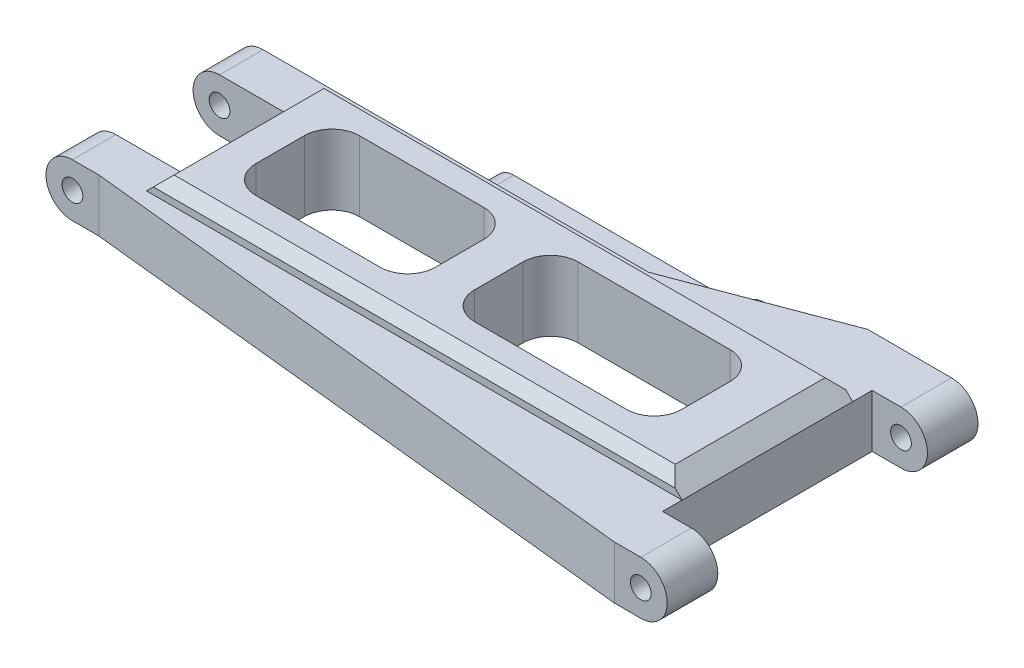
from build123d import *

# Parameters (mm, degrees)
SKETCH1_R           = 1.5
BOSS_EXTRUDE1_DEPTH = 22.5
SKETCH2_W           = 3.83
SKETCH2_H           = 8.7
SKETCH2_W_2         = 8
SKETCH2_H_2         = 30.35
SKETCH2_W_3         = 13.1
SKETCH2_H_3         = 15
CUT_EXTRUDE1_DEPTH  = 55.757415023
BOSS_EXTRUDE2_START = 6.33
SKETCH3_W           = 77.56
SKETCH3_H           = 24.7
BOSS_EXTRUDE2_DEPTH = 6.33
CHAMFER1_SIZE       = 2.5
CHAMFER2_SIZE       = 1.5
BOSS_EXTRUDE3_DEPTH = 3.31
SKETCH5_R           = 3
BOSS_EXTRUDE4_DEPTH = 2.4
FILLET1_R           = 0.5
SKETCH6_R           = 1.25
CUT_EXTRUDE2_DEPTH  = 10


with BuildPart() as part:
    # Sketch1 → Boss-Extrude1 (new, symmetric)
    with BuildSketch(Plane.XY):
        with BuildLine():
            Line((-45.5, 3.83), (45.5, 3.83))
            ThreePointArc((45.5, 3.83), (49.33, 0), (45.5, -3.83))
            Line((45.5, -3.83), (-45.5, -3.83))
            ThreePointArc((-45.5, -3.83), (-49.33, 0), (-45.5, 3.83))
        make_face()
        with Locations(Location((-45.5, 0, 0), (0, 0, 180))):
            Circle(SKETCH1_R, mode=Mode.SUBTRACT)
        with Locations(Location((45.5, 0, 0), (0, 0, 180))):
            Circle(SKETCH1_R, mode=Mode.SUBTRACT)
    extrude(amount=BOSS_EXTRUDE1_DEPTH, both=True)

    # Sketch2 → Cut-Extrude1 (cut, through all)
    with BuildSketch(Plane(origin=(0, 3.83, 0), x_dir=(1, 0, 0), z_dir=(0, 1, 0))):
        Polygon((-10.33, 13.8), (45.5, 13.8), (45.5, 22.5), (-33.33, 22.5), align=None)
        Polygon((41.67, -13.8), (-41.67, -22.5), (45.5, -22.5), (45.5, -13.8), align=None)
        with Locations((47.415, -18.15)):
            Rectangle(SKETCH2_W, SKETCH2_H)
        with Locations((47.415, 18.15)):
            Rectangle(SKETCH2_W, SKETCH2_H)
        with BuildLine():
            Line((-6.43, 7.5), (-28.43, 7.5))
            ThreePointArc((-28.43, 7.5), (-31.258427125, 6.328427125), (-32.43, 3.5))
            Line((-32.43, 3.5), (-32.43, -3.5))
            ThreePointArc((-32.43, -3.5), (-31.258427125, -6.328427125), (-28.43, -7.5))
            Line((-28.43, -7.5), (-6.43, -7.5))
            ThreePointArc((-6.43, -7.5), (-3.601572875, -6.328427125), (-2.43, -3.5))
            Line((-2.43, -3.5), (-2.43, 3.5))
            ThreePointArc((-2.43, 3.5), (-3.601572875, 6.328427125), (-6.43, 7.5))
        make_face()
        with BuildLine():
            Line((25.23, 7.5), (7.23, 7.5))
            ThreePointArc((7.23, 7.5), (4.401572875, 6.328427125), (3.23, 3.5))
            Line((3.23, 3.5), (3.23, -3.5))
            ThreePointArc((3.23, -3.5), (4.401572875, -6.328427125), (7.23, -7.5))
            Line((7.23, -7.5), (25.23, -7.5))
            ThreePointArc((25.23, -7.5), (28.058427125, -6.328427125), (29.23, -3.5))
            Line((29.23, -3.5), (29.23, 3.5))
            ThreePointArc((29.23, 3.5), (28.058427125, 6.328427125), (25.23, 7.5))
        make_face()
        with Locations((-45.33, 0)):
            Rectangle(SKETCH2_W_2, SKETCH2_H_2)
        with Locations((42.78, 0)):
            Rectangle(SKETCH2_W_3, SKETCH2_H_3)
    extrude(amount=-CUT_EXTRUDE1_DEPTH, mode=Mode.SUBTRACT)

    # Sketch3 → Boss-Extrude2 (add)
    with BuildSketch(Plane(origin=(0, 0, 0), x_dir=(1, 0, 0), z_dir=(0, 1, 0)).offset(BOSS_EXTRUDE2_START)):
        with Locations((-2.55, 0)):
            Rectangle(SKETCH3_W, SKETCH3_H)
        with BuildLine():
            ThreePointArc((3.23, -3.5), (4.401572875, -6.328427125), (7.23, -7.5))
            Line((7.23, -7.5), (25.23, -7.5))
            ThreePointArc((25.23, -7.5), (28.058427125, -6.328427125), (29.23, -3.5))
            Line((29.23, -3.5), (29.23, 3.5))
            ThreePointArc((29.23, 3.5), (28.058427125, 6.328427125), (25.23, 7.5))
            Line((25.23, 7.5), (7.23, 7.5))
            ThreePointArc((7.23, 7.5), (4.401572875, 6.328427125), (3.23, 3.5))
            Line((3.23, 3.5), (3.23, -3.5))
        make_face(mode=Mode.SUBTRACT)
        with BuildLine():
            ThreePointArc((-32.43, -3.5), (-31.258427125, -6.328427125), (-28.43, -7.5))
            Line((-28.43, -7.5), (-6.43, -7.5))
            ThreePointArc((-6.43, -7.5), (-3.601572875, -6.328427125), (-2.43, -3.5))
            Line((-2.43, -3.5), (-2.43, 3.5))
            ThreePointArc((-2.43, 3.5), (-3.601572875, 6.328427125), (-6.43, 7.5))
            Line((-6.43, 7.5), (-28.43, 7.5))
            ThreePointArc((-28.43, 7.5), (-31.258427125, 6.328427125), (-32.43, 3.5))
            Line((-32.43, 3.5), (-32.43, -3.5))
        make_face(mode=Mode.SUBTRACT)
    extrude(amount=-BOSS_EXTRUDE2_DEPTH)

    # Chamfer1
    chamfer1_edges = [part.edges().sort_by_distance(p)[0] for p in [
        (36.23, 6.33, 0),
        (-41.33, 6.33, 0),
    ]]
    chamfer(chamfer1_edges, length=CHAMFER1_SIZE)

    # Chamfer2
    chamfer2_edges = [part.edges().sort_by_distance(p)[0] for p in [
        (-2.55, 6.33, 12.35),
        (-2.55, 6.33, -12.35),
    ]]
    chamfer(chamfer2_edges, length=CHAMFER2_SIZE)

    # Sketch4 → Boss-Extrude3 (add)
    with BuildSketch(Plane(origin=(0, 0, -13.8), x_dir=(-1, 0, 0), z_dir=(0, 0, -1))):
        with BuildLine():
            Line((21.5, -2.93), (-12.5, -2.93))
            ThreePointArc((-12.5, -2.93), (-15.43, 0), (-12.5, 2.93))
            Line((-12.5, 2.93), (21.5, 2.93))
            ThreePointArc((21.5, 2.93), (24.43, 0), (21.5, -2.93))
        make_face()
    extrude(amount=BOSS_EXTRUDE3_DEPTH)

    # Sketch5 → Boss-Extrude4 (add)
    with BuildSketch(Plane(origin=(0, 0, -17.11), x_dir=(-1, 0, 0), z_dir=(0, 0, -1))):
        with Locations(Location((21.5, 0, 0), (0, 0, 216.247045378))):
            Circle(SKETCH5_R)
    extrude(amount=BOSS_EXTRUDE4_DEPTH)

    # Fillet1
    fillet1_edges = [part.edges().sort_by_distance(p)[0] for p in [
        (-23.919425287, 1.773804183, -19.51),
    ]]
    fillet(fillet1_edges, radius=FILLET1_R)

    # Sketch6 → Cut-Extrude2 (cut)
    with BuildSketch(Plane(origin=(0, 0, -19.51), x_dir=(-1, 0, 0), z_dir=(0, 0, -1))):
        with Locations((21.5, 0)):
            Circle(SKETCH6_R)
        with Locations((9.1, 0)):
            Circle(SKETCH6_R)
        with Locations((1.9, 0)):
            Circle(SKETCH6_R)
        with Locations((-5.3, 0)):
            Circle(SKETCH6_R)
        with Locations((-12.5, 0)):
            Circle(SKETCH6_R)
        with Locations((-8.9, 0)):
            Circle(SKETCH6_R)
    extrude(amount=-CUT_EXTRUDE2_DEPTH, mode=Mode.SUBTRACT)


with BuildPart() as body_2:
    # Mirror1: mirrored copy
    add(part.part.mirror(Plane(origin=(0, 0, 0), x_dir=(0, 0, 1), z_dir=(1, 0, 0))))


solid = body_2.part
